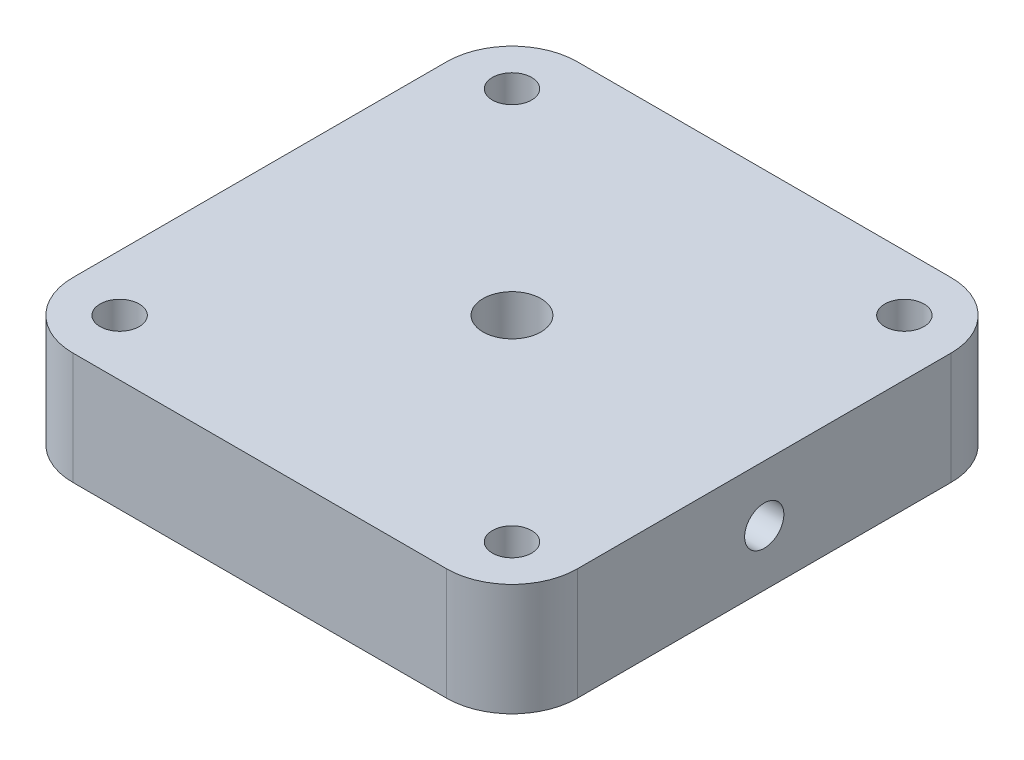
from build123d import *

# Parameters (mm, degrees)
SKETCH_1_R          = 1.55
SKETCH_1_R_2        = 1.05
EXTRUDE_1_DEPTH     = 6
SKETCH_2_R          = 1.05
CUT_EXTRUDE_1_DEPTH = 31.777426793
SKETCH_3_R          = 4
CUT_EXTRUDE_2_DEPTH = 3


with BuildPart() as part:
    # ｽｹｯﾁ1 → ﾎﾞｽ - 押し出し1 (new body)
    with BuildSketch(Plane(origin=(0, 0, 0), x_dir=(1, 0, 0), z_dir=(0, 1, 0))):
        with BuildLine():
            Line((-10, 13.5), (10, 13.5))
            ThreePointArc((10, 13.5), (12.474873734, 12.474873734), (13.5, 10))
            Line((13.5, 10), (13.5, -10))
            ThreePointArc((13.5, -10), (12.474873734, -12.474873734), (10, -13.5))
            Line((10, -13.5), (-10, -13.5))
            ThreePointArc((-10, -13.5), (-12.474873734, -12.474873734), (-13.5, -10))
            Line((-13.5, -10), (-13.5, 10))
            ThreePointArc((-13.5, 10), (-12.474873734, 12.474873734), (-10, 13.5))
        make_face()
        with Locations(Location((0, 0, 0), (0, 0, 270))):
            Circle(SKETCH_1_R, mode=Mode.SUBTRACT)
        with Locations(Location((-10.5, -10.5, 0), (0, 0, 270))):
            Circle(SKETCH_1_R_2, mode=Mode.SUBTRACT)
        with Locations(Location((10.5, -10.5, 0), (0, 0, 270))):
            Circle(SKETCH_1_R_2, mode=Mode.SUBTRACT)
        with Locations(Location((10.5, 10.5, 0), (0, 0, 270))):
            Circle(SKETCH_1_R_2, mode=Mode.SUBTRACT)
        with Locations(Location((-10.5, 10.5, 0), (0, 0, 270))):
            Circle(SKETCH_1_R_2, mode=Mode.SUBTRACT)
    extrude(amount=EXTRUDE_1_DEPTH)

    # ｽｹｯﾁ2 → ｶｯﾄ - 押し出し1 (cut, through all)
    with BuildSketch(Plane(origin=(13.5, 0, 0), x_dir=(0, 0, -1), z_dir=(1, 0, 0))):
        with Locations((0, 3)):
            Circle(SKETCH_2_R)
    extrude(amount=-CUT_EXTRUDE_1_DEPTH, mode=Mode.SUBTRACT)

    # ｽｹｯﾁ3 → ｶｯﾄ - 押し出し2 (cut)
    with BuildSketch(Plane.XZ):
        with Locations(Location((0, 0, 0), (0, 0, 270))):
            Circle(SKETCH_3_R)
    extrude(amount=-CUT_EXTRUDE_2_DEPTH, mode=Mode.SUBTRACT)


solid = part.part
